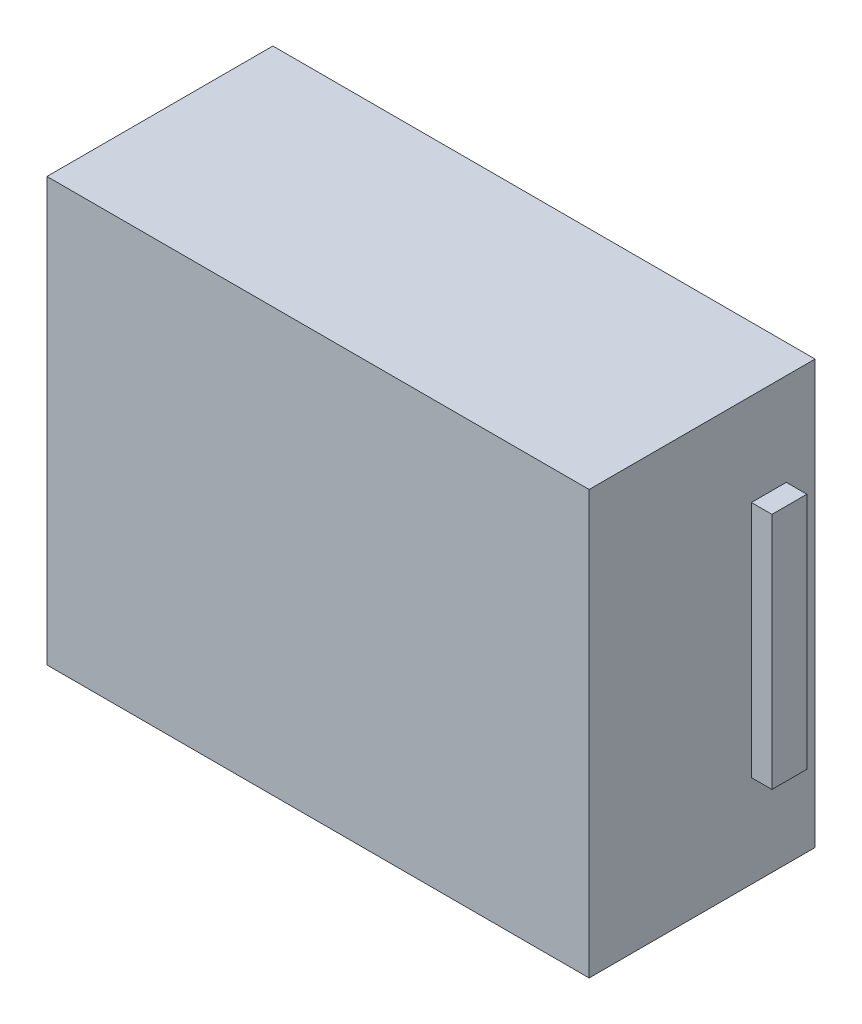
from build123d import *

# Parameters (mm, degrees)
SKETCH1_W           = 132
SKETCH1_H           = 103
BOSS_EXTRUDE1_DEPTH = 55
SKETCH2_W           = 8.5
SKETCH2_H           = 58
BOSS_EXTRUDE2_DEPTH = 5


with BuildPart() as part:
    # Sketch1 → Boss-Extrude1 (new body)
    with BuildSketch(Plane.XY):
        with Locations((66, -51.5)):
            Rectangle(SKETCH1_W, SKETCH1_H)
    extrude(amount=BOSS_EXTRUDE1_DEPTH)

    # Sketch2 → Boss-Extrude2 (add)
    with BuildSketch(Plane(origin=(132, 0, 0), x_dir=(0, 0, -1), z_dir=(1, 0, 0))):
        with Locations((-11.25, -51.5)):
            Rectangle(SKETCH2_W, SKETCH2_H)
    extrude(amount=BOSS_EXTRUDE2_DEPTH)


solid = part.part
